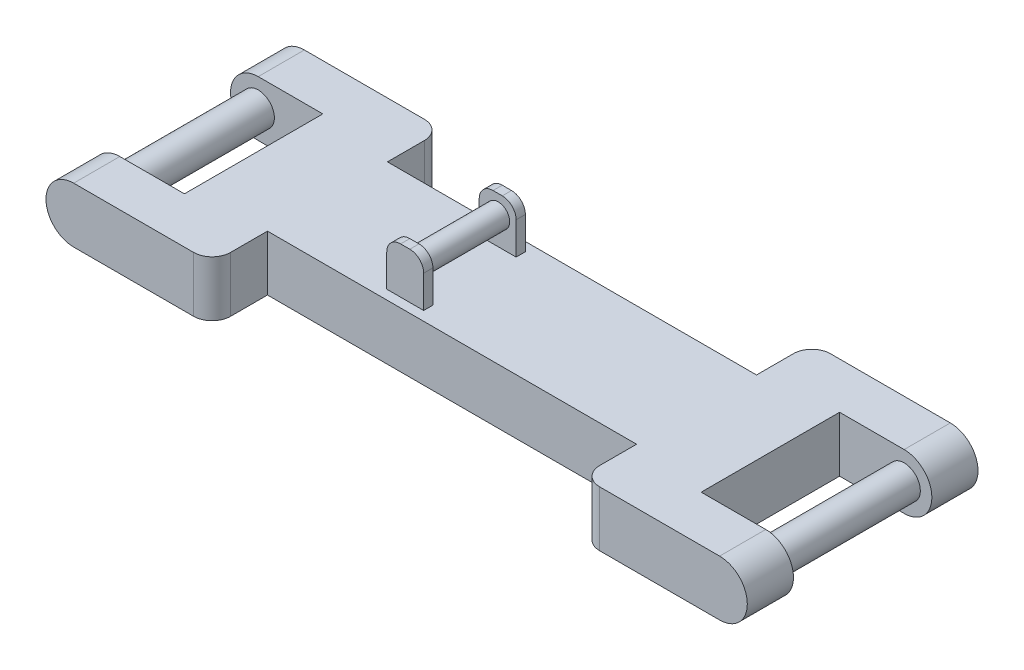
from build123d import *

# Parameters (mm, degrees)
BOSS_EXTRUDE1_DEPTH = 125
SKETCH2_W           = 35
SKETCH2_H           = 75
SKETCH2_W_2         = 15
CUT_EXTRUDE1_DEPTH  = 100
SKETCH3_R           = 8.75
BOSS_EXTRUDE2_DEPTH = 75
SKETCH4_W           = 200
SKETCH4_H           = 30
CUT_EXTRUDE2_DEPTH  = 230.401394939
FILLET1_R           = 10
SKETCH6_R           = 6.25
BOSS_EXTRUDE3_DEPTH = 22.5
SKETCH7_W           = 20
SKETCH7_H           = 5
BOSS_EXTRUDE4_DEPTH = 40
FILLET2_R           = 7.5


with BuildPart() as part:
    # Sketch1 → Boss-Extrude1 (new body)
    with BuildSketch(Plane.XY):
        with BuildLine():
            Line((-175, 15), (175, 15))
            ThreePointArc((175, 15), (190, 0), (175, -15))
            Line((175, -15), (-175, -15))
            ThreePointArc((-175, -15), (-190, 0), (-175, 15))
        make_face()
    extrude(amount=BOSS_EXTRUDE1_DEPTH)

    # Sketch2 → Cut-Extrude1 (cut)
    with BuildSketch(Plane(origin=(0, 15, 0), x_dir=(1, 0, 0), z_dir=(0, 1, 0))):
        with Locations((-157.5, -62.5)):
            Rectangle(SKETCH2_W, SKETCH2_H)
        with Locations((-182.5, -62.5)):
            Rectangle(SKETCH2_W_2, SKETCH2_H)
        with Locations((182.5, -62.5)):
            Rectangle(SKETCH2_W_2, SKETCH2_H)
        with Locations((157.5, -62.5)):
            Rectangle(SKETCH2_W, SKETCH2_H)
    extrude(amount=-CUT_EXTRUDE1_DEPTH, mode=Mode.SUBTRACT)

    # Sketch3 → Boss-Extrude2 (add)
    with BuildSketch(Plane.XY.offset(25)):
        with Locations(Location((-175, 0, 0), (0, 0, 180))):
            Circle(SKETCH3_R)
        with Locations(Location((175, 0, 0), (0, 0, 180))):
            Circle(SKETCH3_R)
    extrude(amount=BOSS_EXTRUDE2_DEPTH)

    # Sketch4 → Cut-Extrude2 (cut, through all)
    with BuildSketch(Plane(origin=(0, 15, 0), x_dir=(1, 0, 0), z_dir=(0, 1, 0))):
        with Locations((0, -15)):
            Rectangle(SKETCH4_W, SKETCH4_H)
        with Locations((0, -110)):
            Rectangle(SKETCH4_W, SKETCH4_H)
    extrude(amount=-CUT_EXTRUDE2_DEPTH, mode=Mode.SUBTRACT)

    # Fillet1
    fillet1_edges = [part.edges().sort_by_distance(p)[0] for p in [
        (-100, 0, 0),
        (100, 0, 0),
        (100, 0, 125),
        (-100, 0, 125),
    ]]
    fillet(fillet1_edges, radius=FILLET1_R)



with BuildPart() as body_2:
    # Sketch6 → Boss-Extrude3 (new, symmetric)
    with BuildSketch(Plane.XY.offset(62.5)):
        with Locations(Location((-30, 30, 0), (0, 0, 180))):
            Circle(SKETCH6_R)
    extrude(amount=BOSS_EXTRUDE3_DEPTH, both=True)


with BuildPart() as part_1:
    add(part.part)

    add(body_2.part)  # Boss-Extrude4 merges body 2
    # Sketch7 → Boss-Extrude4 (add)
    with BuildSketch(Plane(origin=(0, 0, 0), x_dir=(1, 0, 0), z_dir=(0, 1, 0))):
        with Locations((-30.433316443, -87.433842939)):
            Rectangle(SKETCH7_W, SKETCH7_H)
        with Locations((-30.433316443, -37.333363873)):
            Rectangle(SKETCH7_W, SKETCH7_H)
    extrude(amount=BOSS_EXTRUDE4_DEPTH)

    # Fillet2
    fillet2_edges = [part_1.edges().sort_by_distance(p)[0] for p in [
        (-20.433316443, 40, 87.433842939),
        (-40.433316443, 40, 87.433842939),
        (-40.433316443, 40, 37.333363873),
        (-20.433316443, 40, 37.333363873),
    ]]
    fillet(fillet2_edges, radius=FILLET2_R)


solid = part_1.part
